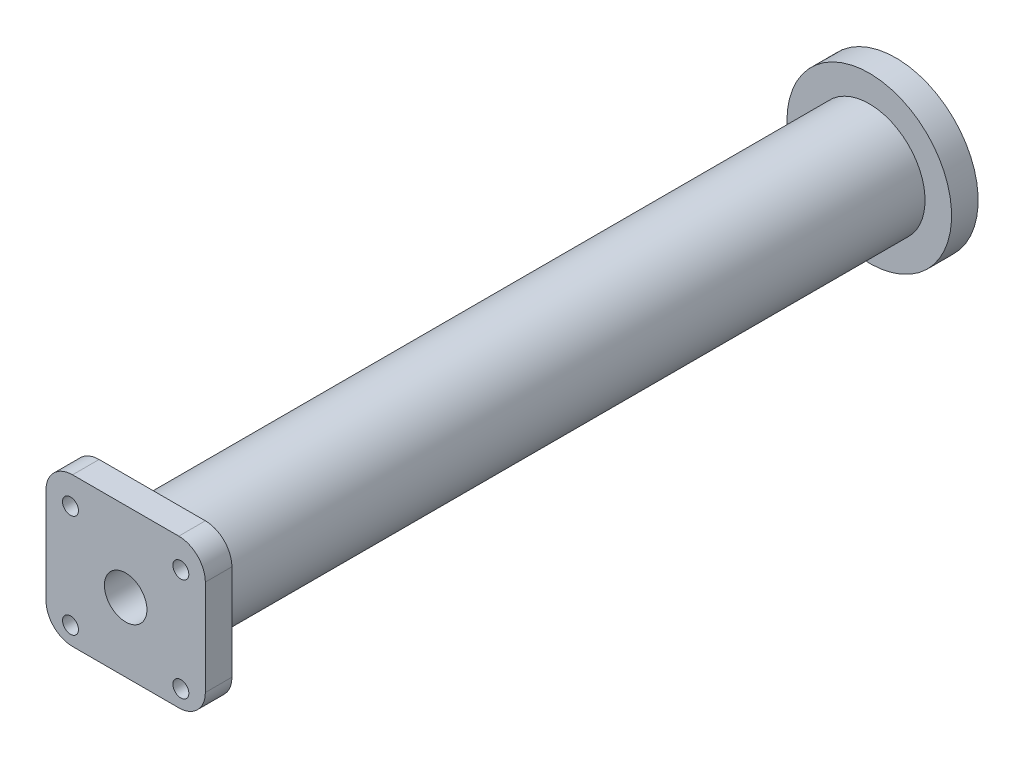
from build123d import *

# Parameters (mm, degrees)
SKETCH1_R           = 10.5
SKETCH1_R_2         = 4
BOSS_EXTRUDE1_DEPTH = 140
SKETCH2_W           = 30
SKETCH2_H           = 28
SKETCH2_R           = 1.5
SKETCH2_R_2         = 4
BOSS_EXTRUDE2_DEPTH = 5
FILLET1_R           = 5
SKETCH3_R           = 15.5
SKETCH3_R_2         = 10.5
EXTRUDE_THIN1_DEPTH = 5


with BuildPart() as part:
    # Sketch1 → Boss-Extrude1 (new body)
    with BuildSketch(Plane.XY):
        Circle(SKETCH1_R)
        Circle(SKETCH1_R_2, mode=Mode.SUBTRACT)
    extrude(amount=BOSS_EXTRUDE1_DEPTH)

    # Sketch2 → Boss-Extrude2 (add)
    with BuildSketch(Plane.XY.offset(140)):
        with Locations((0, 1)):
            Rectangle(SKETCH2_W, SKETCH2_H)
        with Locations((-10.388295362, 9.695742338)):
            Circle(SKETCH2_R, mode=Mode.SUBTRACT)
        with Locations((10.388295362, -9.695742338)):
            Circle(SKETCH2_R, mode=Mode.SUBTRACT)
        with Locations((10.388295362, 9.695742338)):
            Circle(SKETCH2_R, mode=Mode.SUBTRACT)
        with Locations((-10.388295362, -9.695742338)):
            Circle(SKETCH2_R, mode=Mode.SUBTRACT)
        Circle(SKETCH2_R_2, mode=Mode.SUBTRACT)
    extrude(amount=BOSS_EXTRUDE2_DEPTH)

    # Fillet1
    fillet1_edges = [part.edges().sort_by_distance(p)[0] for p in [
        (15, -13, 142.5),
        (15, 15, 142.5),
        (-15, 15, 142.5),
        (-15, -13, 142.5),
    ]]
    fillet(fillet1_edges, radius=FILLET1_R)

    # Sketch3 → Extrude-Thin1 (add)
    with BuildSketch(Plane(origin=(0, 0, 0), x_dir=(-1, 0, 0), z_dir=(0, 0, -1))):
        Circle(SKETCH3_R)
        Circle(SKETCH3_R_2, mode=Mode.SUBTRACT)
    extrude(amount=-EXTRUDE_THIN1_DEPTH)


solid = part.part
